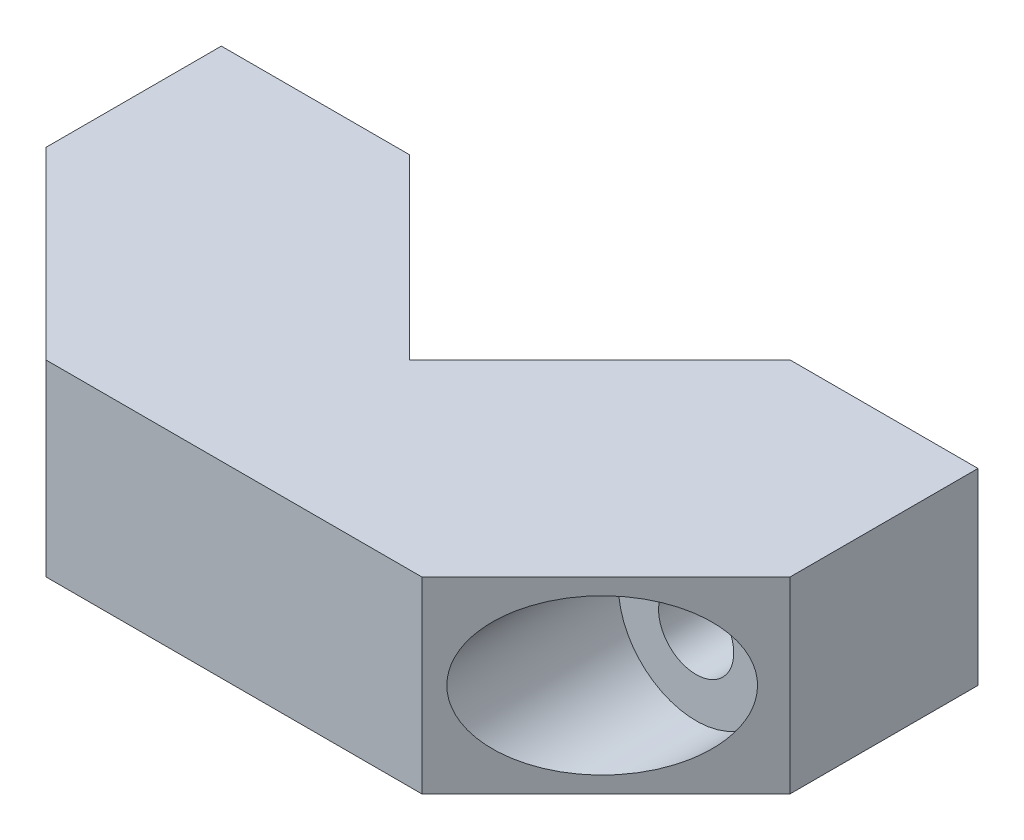
from build123d import *

# Parameters (mm, degrees)
BOSS_EXTRUDE1_DEPTH = 12.7
CUT_EXTRUDE3_START  = 0.848528
SKETCH3_R           = 2.54
CUT_EXTRUDE3_DEPTH  = 12.7
SKETCH4_R           = 5.25
CUT_EXTRUDE4_DEPTH  = 12.7


with BuildPart() as part:
    # Sketch2 → Boss-Extrude1 (new body)
    with BuildSketch(Plane(origin=(0, 0, 0), x_dir=(1, 0, 0), z_dir=(0, 1, 0))):
        Polygon((-23.425952314, 11.801132082), (-11.405137034, -0.219683198), (1.464206384, 12.649660219), (14.164206384, 12.649660219), (14.164206384, -0.050339781), (1.719127035, -12.495419129), (-23.680872965, -12.495419129), (-36.125952314, -0.050339781), (-36.125952314, 11.801132082), align=None)
    extrude(amount=BOSS_EXTRUDE1_DEPTH)

    # Sketch3 → Cut-Extrude3 (cut)
    with BuildSketch(Plane(origin=(0, 0, -11.801132082), x_dir=(-1, 0, 0), z_dir=(0, 0, -1)).offset(CUT_EXTRUDE3_START)):
        with Locations(Location((-7.814206384, 6.35, 0), (0, 0, 180))):
            Circle(SKETCH3_R)
        with Locations(Location((29.775952314, 6.35, 0), (0, 0, 180))):
            Circle(SKETCH3_R)
    extrude(amount=-CUT_EXTRUDE3_DEPTH, mode=Mode.SUBTRACT)

    # Sketch4 → Cut-Extrude4 (cut)
    with BuildSketch(Plane(origin=(0, 0, 0.050339781), x_dir=(-1, 0, 0), z_dir=(0, 0, -1))):
        with Locations((-7.814206384, 6.35)):
            Circle(SKETCH4_R)
        with Locations((29.775952314, 6.35)):
            Circle(SKETCH4_R)
    extrude(amount=-CUT_EXTRUDE4_DEPTH, mode=Mode.SUBTRACT)


solid = part.part
